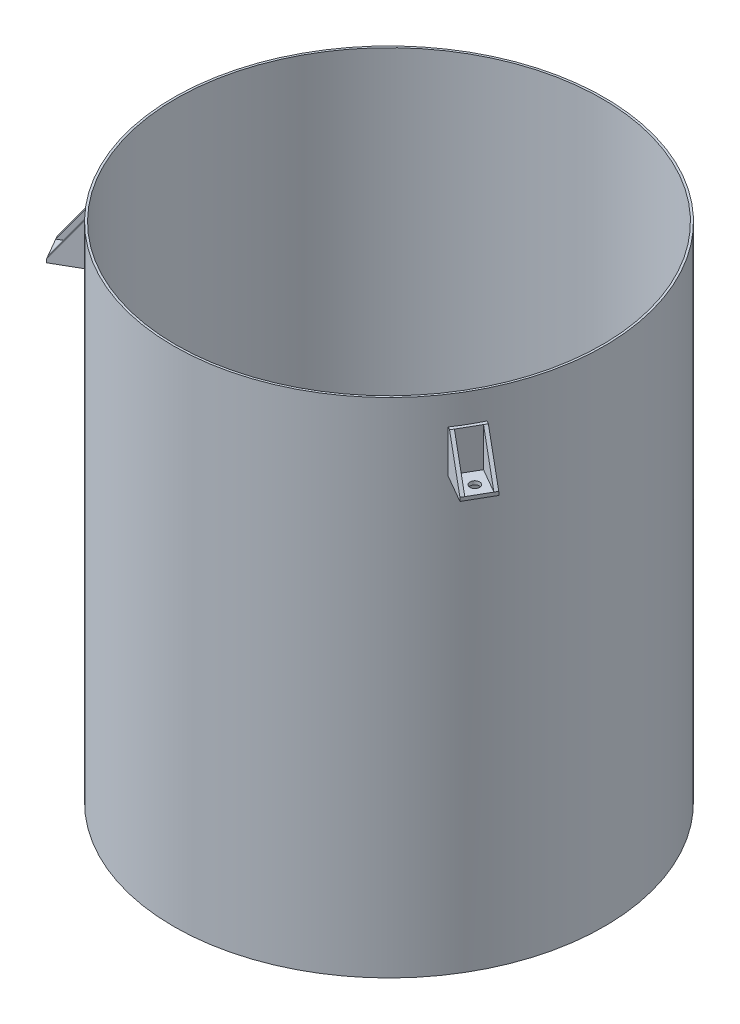
from build123d import *

# Parameters (mm, degrees)
SKETCH1_R                       = 303
SKETCH1_R_2                     = 300
BOSS_EXTRUDE1_DEPTH             = 707.4
BOSS_EXTRUDE2_DEPTH             = 60
BOSS_EXTRUDE3_DEPTH             = 40
CUT_EXTRUDE1_DEPTH              = 40
CIRPATTERN1_COUNT               = 3
SKETCH12_R                      = 6.75
CUT_EXTRUDE2_DEPTH              = 40
SKETCH13_R                      = 28
SKETCH13_R_2                    = 25
BOSS_EXTRUDE5_DEPTH             = 50
BOSS_EXTRUDE5_DIRECTION_2_REACH = 891.325
CUT_EXTRUDE4_DEPTH              = 10
CUT_EXTRUDE4_DEPTH_BACK         = 60
SKETCH15_R                      = 25


with BuildPart() as part:
    # Sketch1 → Boss-Extrude1 (new body)
    with BuildSketch(Plane(origin=(0, 0, 0), x_dir=(1, 0, 0), z_dir=(0, 1, 0))):
        with Locations(Location((0, 0, 0), (0, 0, 270))):
            Circle(SKETCH1_R)
        with Locations(Location((0, 0, 0), (0, 0, 270))):
            Circle(SKETCH1_R_2, mode=Mode.SUBTRACT)
    extrude(amount=BOSS_EXTRUDE1_DEPTH)

    # Sketch7 → Boss-Extrude2 (add)
    with BuildSketch(Plane(origin=(0, 607.4, 0), x_dir=(1, 0, 0), z_dir=(0, 1, 0))):
        with BuildLine():
            Line((0, 307.339213467), (20, 307.339213467))
            Line((20, 307.339213467), (20, 302.339213467))
            ThreePointArc((20, 302.339213467), (0, 303), (-20, 302.339213467))
            Line((-20, 302.339213467), (-20, 307.339213467))
            Line((-20, 307.339213467), (0, 307.339213467))
        make_face()
    boss_extrude2 = extrude(amount=BOSS_EXTRUDE2_DEPTH)

    # Sketch8 → Boss-Extrude3 (add)
    with BuildSketch(Plane(origin=(0, 0, -307.339213467), x_dir=(-1, 0, 0), z_dir=(0, 0, -1))):
        Polygon((-20, 667.4), (-20, 607.4), (20, 607.4), (20, 667.4), (15, 667.4), (15, 612.4), (-15, 612.4), (-15, 667.4), align=None)
    boss_extrude3 = extrude(amount=BOSS_EXTRUDE3_DEPTH)

    # Sketch11 → Cut-Extrude1 (cut)
    with BuildSketch(Plane(origin=(20, 0, 0), x_dir=(0, 0, -1), z_dir=(1, 0, 0))):
        Polygon((307.339213467, 667.4), (347.339213467, 612.4), (347.339213467, 667.4), align=None)
    cut_extrude1 = extrude(amount=-CUT_EXTRUDE1_DEPTH, mode=Mode.SUBTRACT)

    # CirPattern1: Boss-Extrude2, Boss-Extrude3, Cut-Extrude1 ×3 about axis
    cirpattern1_axis = Axis((0, 0, 0), (0, 1, 0))
    add([boss_extrude2.rotate(cirpattern1_axis, i * 360 / CIRPATTERN1_COUNT) for i in range(1, CIRPATTERN1_COUNT)])
    add([boss_extrude3.rotate(cirpattern1_axis, i * 360 / CIRPATTERN1_COUNT) for i in range(1, CIRPATTERN1_COUNT)])
    add([cut_extrude1.rotate(cirpattern1_axis, i * 360 / CIRPATTERN1_COUNT) for i in range(1, CIRPATTERN1_COUNT)], mode=Mode.SUBTRACT)

    # Sketch12 → Cut-Extrude2 (cut)
    with BuildSketch(Plane(origin=(0, 612.4, 0), x_dir=(1, 0, 0), z_dir=(0, 1, 0))):
        with Locations(Location((0, 330, 0), (0, 0, 270))):
            Circle(SKETCH12_R)
        with Locations(Location((285.788383249, -165, 0), (0, 0, 270))):
            Circle(SKETCH12_R)
        with Locations(Location((-285.788383249, -165, 0), (0, 0, 270))):
            Circle(SKETCH12_R)
    extrude(amount=-CUT_EXTRUDE2_DEPTH, mode=Mode.SUBTRACT)


with BuildPart() as body_2:
    # Sketch3 → Revolve8 (revolve)
    with BuildSketch(Plane(origin=(0, 0, 0), x_dir=(0, 0, -1), z_dir=(1, 0, 0)), mode=Mode.PRIVATE) as revolve8_sk:
        with BuildLine():
            ThreePointArc((283.607802277, -3.200032627), (288.572995435, -1.61376908), (293.529317105, 0))
            Line((293.529317105, 0), (0, -47))
            Line((0, -47), (0, -50))
            Line((0, -50), (283.607802277, -3.200032627))
        make_face()
    revolve(revolve8_sk.sketch.rotate(Axis((0, 0, 0), (0, -1, 0)), 180), axis=Axis((0, 0, 0), (0, -1, 0)))

    # Sketch15 → Cut-Extrude4 (cut, two sides: drawn at the far end of the back side and taken through both)
    with BuildSketch(Plane(origin=(0, -50, 0), x_dir=(1, 0, 0), z_dir=(0, 1, 0)).offset(-CUT_EXTRUDE4_DEPTH_BACK)):
        with Locations(Location((0, 0, 0), (0, 0, 270))):
            Circle(SKETCH15_R)
    extrude(amount=CUT_EXTRUDE4_DEPTH + CUT_EXTRUDE4_DEPTH_BACK, mode=Mode.SUBTRACT)


with BuildPart() as body_3:
    # Sketch13 → Boss-Extrude5 (new body)
    with BuildSketch(Plane(origin=(0, -50, 0), x_dir=(1, 0, 0), z_dir=(0, 1, 0))):
        with Locations(Location((0, 0, 0), (0, 0, 270))):
            Circle(SKETCH13_R)
        with Locations(Location((0, 0, 0), (0, 0, 270))):
            Circle(SKETCH13_R_2, mode=Mode.SUBTRACT)
    extrude(amount=-BOSS_EXTRUDE5_DEPTH)

    # Boss-Extrude5 direction 2: up to this cone (the profile starts outside it)
    boss_extrude5_direction_2_end = Plane(origin=(0, -50, 0), z_dir=(0, 1, 0)).offset(1e-06) * Cone(6.06e-06, 5404.4595, 891.824999, align=(Align.CENTER, Align.CENTER, Align.MIN), mode=Mode.PRIVATE)
    # Sketch13 → Boss-Extrude5 direction 2 (add, up to the surface)
    with BuildSketch(Plane(origin=(0, -50, 0), x_dir=(1, 0, 0), z_dir=(0, 1, 0)), mode=Mode.PRIVATE) as boss_extrude5_direction_2_sk1:
        with Locations(Location((0, 0, 0), (0, 0, 270))):
            Circle(SKETCH13_R)
        with Locations(Location((0, 0, 0), (0, 0, 270))):
            Circle(SKETCH13_R_2, mode=Mode.SUBTRACT)
    boss_extrude5_direction_2_tool1 = extrude(boss_extrude5_direction_2_sk1.sketch, amount=BOSS_EXTRUDE5_DIRECTION_2_REACH, mode=Mode.PRIVATE) - boss_extrude5_direction_2_end
    add(boss_extrude5_direction_2_tool1.solids().sort_by_distance((0, -50, -27.20804))[0])


solid = Compound([part.part, body_2.part, body_3.part])
